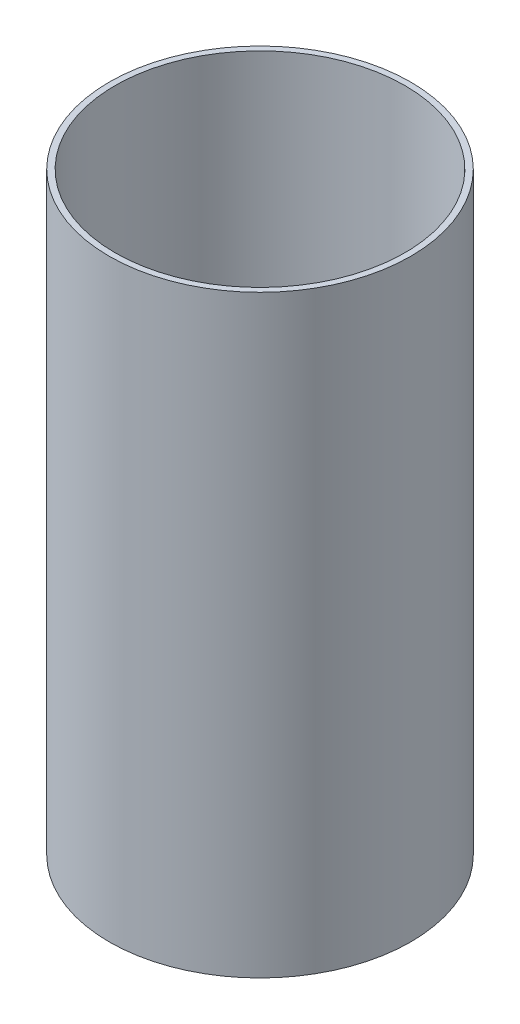
from build123d import *

# Parameters (mm, degrees)
BOSS_EXTRUDE1_DEPTH      = 150
BOSS_EXTRUDE1_DEPTH_BACK = 150
SKETCH1_R                = 76.2
SKETCH1_R_2              = 73.2


with BuildPart() as part:
    # Sketch1 → Boss-Extrude1 (new, two sides: drawn at the far end of the back side and taken through both)
    with BuildSketch(Plane(origin=(0, 0, 0), x_dir=(1, 0, 0), z_dir=(0, 1, 0)).offset(-BOSS_EXTRUDE1_DEPTH_BACK)):
        with Locations(Location((0, 0, 0), (0, 0, 270))):
            Circle(SKETCH1_R)
        with Locations(Location((0, 0, 0), (0, 0, 270))):
            Circle(SKETCH1_R_2, mode=Mode.SUBTRACT)
    extrude(amount=BOSS_EXTRUDE1_DEPTH + BOSS_EXTRUDE1_DEPTH_BACK)


solid = part.part
